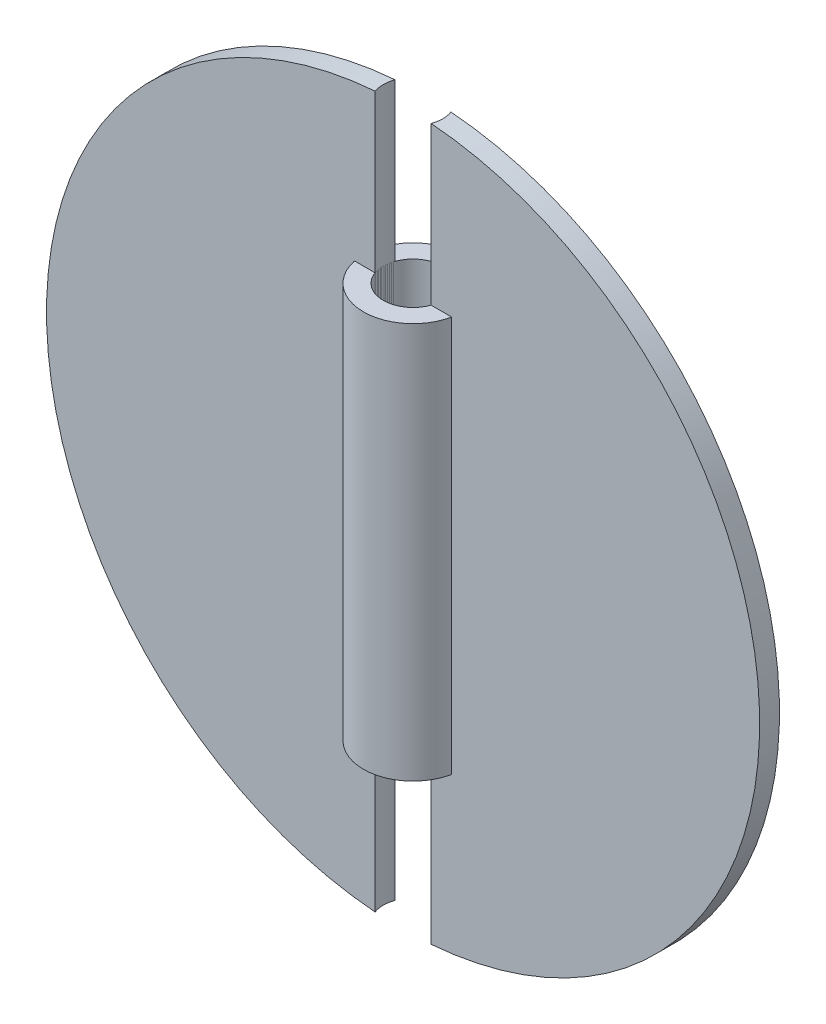
from build123d import *

# Parameters (mm, degrees)
SKETCH1_R                = 36
BOSS_EXTRUDE1_DEPTH      = 2
BOSS_EXTRUDE2_DEPTH      = 20.0001
BOSS_EXTRUDE2_DEPTH_BACK = 20
SKETCH2_R                = 5
SKETCH2_R_2              = 3
CUT_EXTRUDE1_DEPTH       = 20
CUT_EXTRUDE1_DEPTH_BACK  = 67.843183647
SKETCH3_R                = 3


with BuildPart() as part:
    # Sketch1 → Boss-Extrude1 (new body)
    with BuildSketch(Plane.XY):
        Circle(SKETCH1_R)
    extrude(amount=BOSS_EXTRUDE1_DEPTH)

    # Sketch3 → Cut-Extrude1 (cut, two sides: drawn at the far end of the back side and taken through both)
    with BuildSketch(Plane(origin=(0, 20.0001, 0), x_dir=(1, 0, 0), z_dir=(0, 1, 0)).offset(-CUT_EXTRUDE1_DEPTH_BACK)):
        with Locations((0, -1)):
            Circle(SKETCH3_R)
    extrude(amount=CUT_EXTRUDE1_DEPTH + CUT_EXTRUDE1_DEPTH_BACK, mode=Mode.SUBTRACT)


with BuildPart() as body_2:
    # Sketch2 → Boss-Extrude2 (new, two sides: drawn at the far end of the back side and taken through both)
    with BuildSketch(Plane(origin=(0, 0, 0), x_dir=(1, 0, 0), z_dir=(0, 1, 0)).offset(-BOSS_EXTRUDE2_DEPTH_BACK)):
        with Locations((0, -1)):
            Circle(SKETCH2_R)
        with Locations((0, -1)):
            Circle(SKETCH2_R_2, mode=Mode.SUBTRACT)
    extrude(amount=BOSS_EXTRUDE2_DEPTH + BOSS_EXTRUDE2_DEPTH_BACK)


with BuildPart() as cut_extrude1_piece_1:
    # of the separate pieces the step leaves, piece 1, a body of its own (cut_extrude1_pieces)
    add(part.part.solids().sort_by_distance((2.828427125, -35.88871689, 0))[0])


with BuildPart() as cut_extrude1_piece_2:
    # of the separate pieces the step leaves, piece 2, a body of its own (cut_extrude1_pieces)
    add(part.part.solids().sort_by_distance((-2.828427125, 35.88871689, 0))[0])


solid = Compound([body_2.part, cut_extrude1_piece_1.part, cut_extrude1_piece_2.part])
